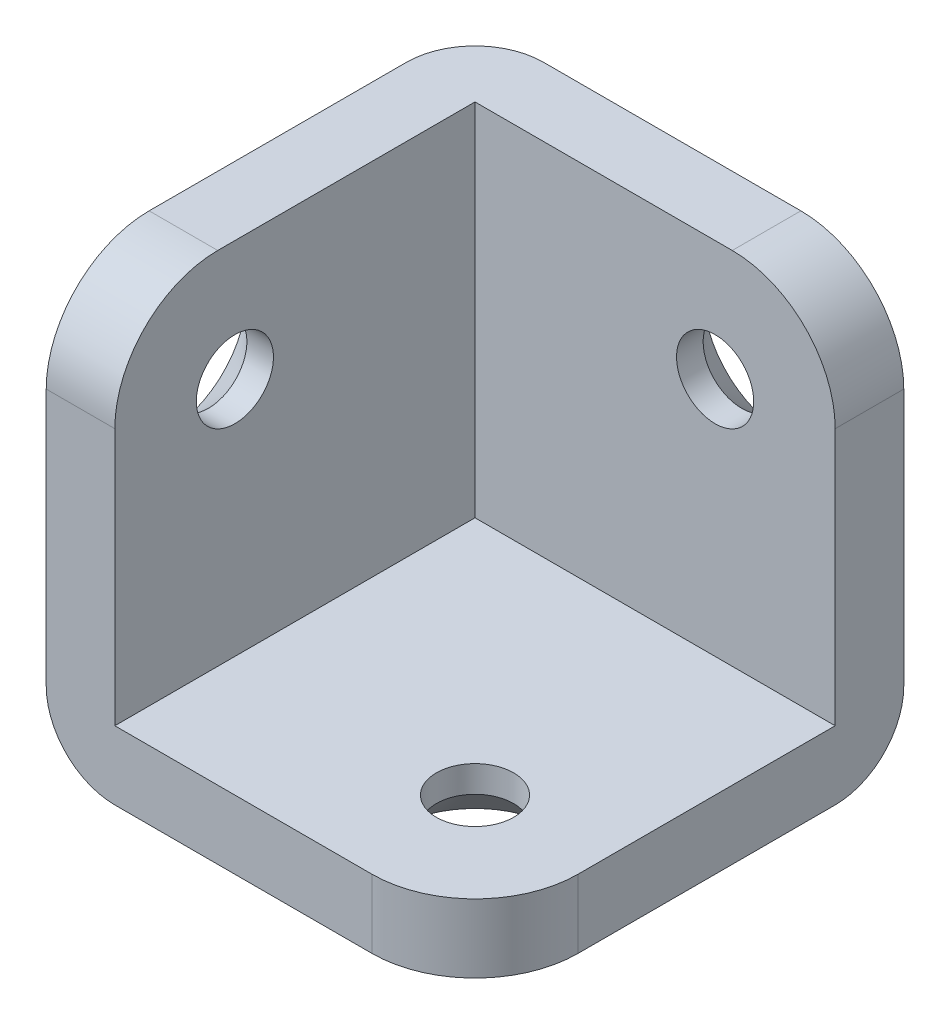
from build123d import *

# Parameters (mm, degrees)
SKETCH1_W           = 25
SKETCH1_H           = 25
BOSS_EXTRUDE1_DEPTH = 25
SKETCH2_W           = 21
SKETCH2_H           = 21
CUT_EXTRUDE1_DEPTH  = 21
FILLET1_R           = 6
FILLET2_R           = 4


with BuildPart() as part:
    # Sketch1 → Boss-Extrude1 (new body)
    with BuildSketch(Plane(origin=(0, 0, 0), x_dir=(1, 0, 0), z_dir=(0, 1, 0))):
        with Locations((12.5, -12.5)):
            Rectangle(SKETCH1_W, SKETCH1_H)
    extrude(amount=BOSS_EXTRUDE1_DEPTH)

    # Sketch2 → Cut-Extrude1 (cut)
    with BuildSketch(Plane(origin=(0, 25, 0), x_dir=(1, 0, 0), z_dir=(0, 1, 0))):
        with Locations((14.5, -14.5)):
            Rectangle(SKETCH2_W, SKETCH2_H)
    extrude(amount=-CUT_EXTRUDE1_DEPTH, mode=Mode.SUBTRACT)

    # Fillet1
    fillet1_edges = [part.edges().sort_by_distance(p)[0] for p in [
        (25, 25, 2),
        (25, 2, 25),
        (2, 25, 25),
    ]]
    fillet(fillet1_edges, radius=FILLET1_R)

    # Sketch4 → CSK for M4 Countersunk Flat Head Screw2 (revolve, cut)
    with BuildSketch(Plane(origin=(18, 18, 0), x_dir=(0, 1, 0), z_dir=(1, 0, 0))):
        Polygon((0, 0), (0, 4), (2.25, 4), (2.25, 2.45), (4.7, 0), align=None)
    revolve(axis=Axis((18, 18, -6.35), (0, 0, 1)), mode=Mode.SUBTRACT)

    # Sketch4 at point 2 (carried to point 2, square into its face) → CSK for M4 Countersunk Flat Head Scr 2 (revolve, cut)
    with BuildSketch(Plane(origin=(0, 18, 18), x_dir=(0, 1, 0), z_dir=(0, 0, -1))):
        Polygon((0, 0), (0, 4), (2.25, 4), (2.25, 2.45), (4.7, 0), align=None)
    revolve(axis=Axis((-6.35, 18, 18), (1, 0, 0)), mode=Mode.SUBTRACT)

    # Sketch4 at point 3 (carried to point 3, square into its face) → CSK for M4 Countersunk Flat Head Scr 3 (revolve, cut)
    with BuildSketch(Plane(origin=(18, 0, 18), x_dir=(0, 0, -1), z_dir=(1, 0, 0))):
        Polygon((0, 0), (0, 4), (2.25, 4), (2.25, 2.45), (4.7, 0), align=None)
    revolve(axis=Axis((18, -6.35, 18), (0, 1, 0)), mode=Mode.SUBTRACT)

    # Fillet2
    fillet2_edges = [part.edges().sort_by_distance(p)[0] for p in [
        (12.5, 0, 0),
        (0, 0, 12.5),
        (0, 12.5, 0),
    ]]
    fillet(fillet2_edges, radius=FILLET2_R)


solid = part.part
